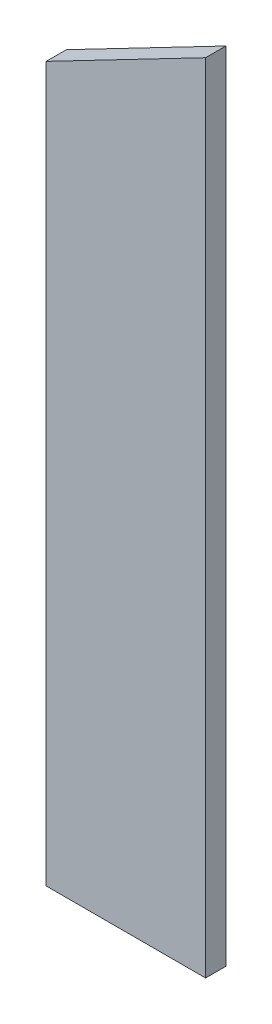
from build123d import *

# Parameters (mm, degrees)
BOSS_EXTRUDE1_DEPTH = 6.35


with BuildPart() as part:
    # Sketch1 → Boss-Extrude1 (new body)
    with BuildSketch(Plane.XY):
        Polygon((-25, -112), (25, -112), (25, 138), (-25, 112), align=None)
    extrude(amount=BOSS_EXTRUDE1_DEPTH)


solid = part.part
